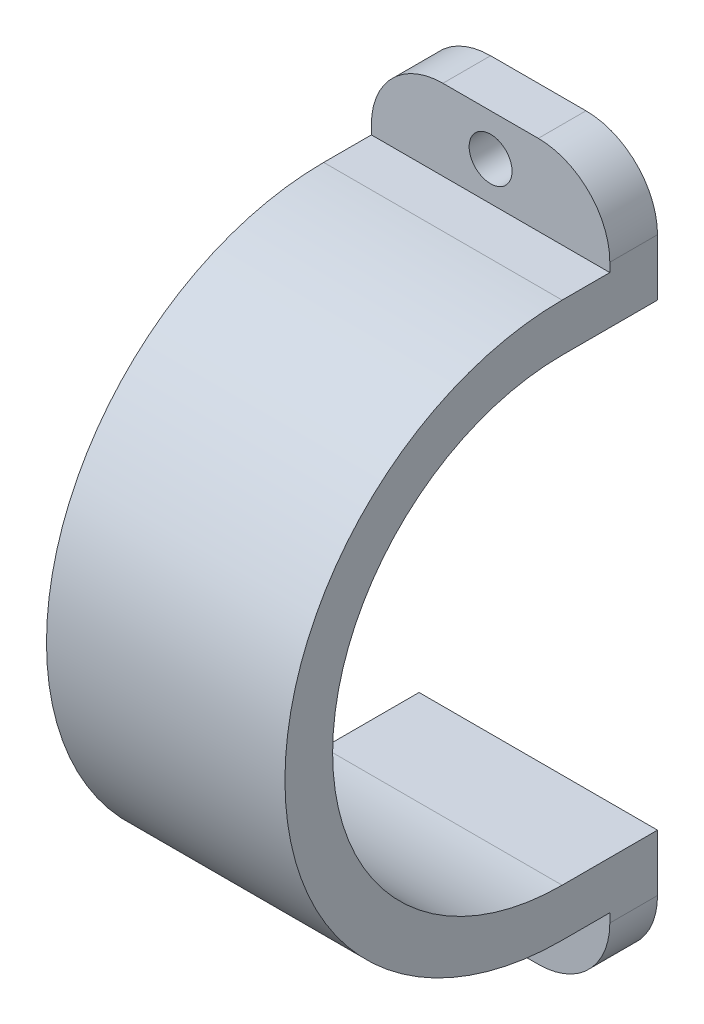
from build123d import *

# Parameters (mm, degrees)
MOTOR_CLAMP_EXTRUDE_DEPTH = 20
CLAMP_CLEARANCE_HOLE_D    = 3.6
CLAMP_CORNER_FILLETS_R    = 6


with BuildPart() as part:
    # Hold Down Bracket Sketch → Motor Clamp Extrude (new body)
    with BuildSketch(Plane(origin=(0, 0, 0), x_dir=(0, 0, -1), z_dir=(1, 0, 0))):
        with BuildLine():
            Line((-33.5, -23.25), (-29.5, -23.25))
            Line((-29.5, -23.25), (-29.5, -30))
            Line((-29.5, -30), (-25.5, -30))
            Line((-25.5, -30), (-25.5, -19.25))
            Line((-25.5, -19.25), (-33.5, -19.25))
            ThreePointArc((-33.5, -19.25), (-52.75, 0), (-33.5, 19.25))
            Line((-33.5, 19.25), (-25.5, 19.25))
            Line((-25.5, 19.25), (-25.5, 30))
            Line((-25.5, 30), (-29.5, 30))
            Line((-29.5, 30), (-29.5, 23.25))
            Line((-29.5, 23.25), (-33.5, 23.25))
            ThreePointArc((-33.5, 23.25), (-56.75, 0), (-33.5, -23.25))
        make_face()
    extrude(amount=MOTOR_CLAMP_EXTRUDE_DEPTH)

    # Clamp Clearance Hole (through all)
    with Locations(Plane.XY.offset(29.5)):
        with Locations((10, -26.5)):
            clamp_clearance_hole = Hole(CLAMP_CLEARANCE_HOLE_D / 2)

    # Clamp Clearance Hole Mirror: Clamp Clearance Hole across plane
    add(clamp_clearance_hole.mirror(Plane.ZX), mode=Mode.SUBTRACT)

    # Clamp Corner Fillets
    clamp_corner_fillets_edges = [part.edges().sort_by_distance(p)[0] for p in [
        (0, 30, 27.5),
        (0, -30, 27.5),
        (20, -30, 27.5),
        (20, 30, 27.5),
    ]]
    fillet(clamp_corner_fillets_edges, radius=CLAMP_CORNER_FILLETS_R)


solid = part.part
